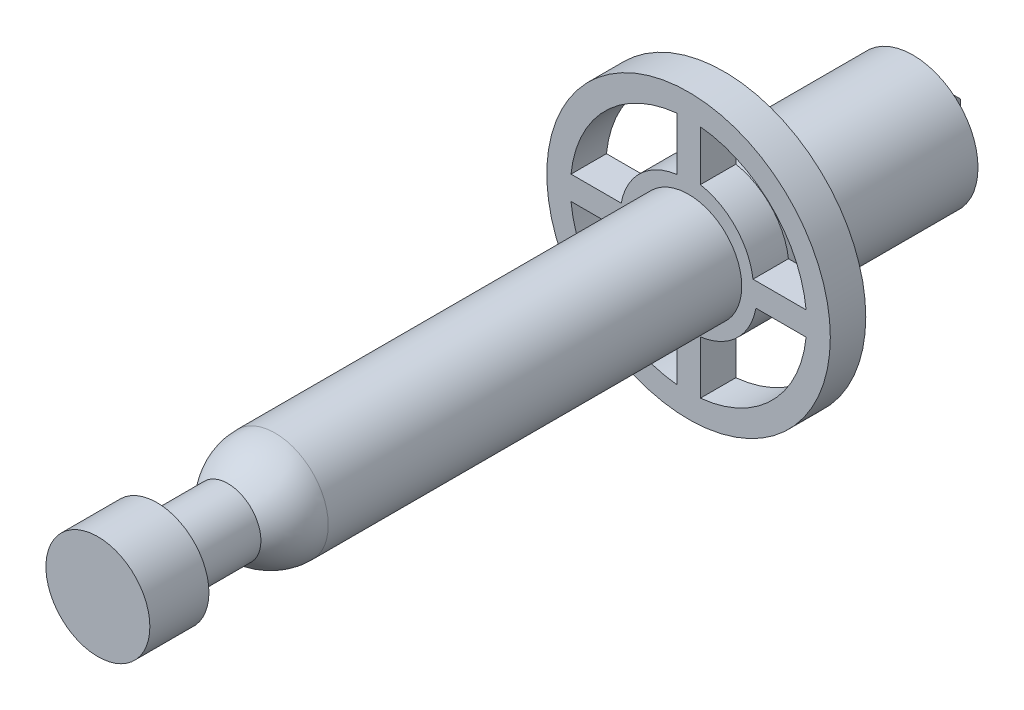
from build123d import *

# Parameters (mm, degrees)
SKETCH1_R           = 2.75
BOSS_EXTRUDE1_DEPTH = 8
SKETCH5_R           = 2.25
BOSS_EXTRUDE2_DEPTH = 19
SKETCH6_R           = 6
BOSS_EXTRUDE4_DEPTH = 1.5
CUT_EXTRUDE1_DEPTH  = 1.5
CIRPATTERN1_COUNT   = 4
SKETCH11_R          = 1.4
BOSS_EXTRUDE5_DEPTH = 3
SKETCH12_R          = 2.2
BOSS_EXTRUDE6_DEPTH = 2.5


with BuildPart() as part:
    # Sketch1 → Boss-Extrude1 (new body)
    with BuildSketch(Plane.XY):
        with Locations((0, -0.147315355)):
            Circle(SKETCH1_R)
    extrude(amount=BOSS_EXTRUDE1_DEPTH)

    # Sketch4 → Revolve2 (revolve)
    with BuildSketch(Plane(origin=(0, 0, 0), x_dir=(1, 0, 0), z_dir=(0, 1, 0))):
        Polygon((0, 0), (0, 2), (-2, 0), align=None)
    revolve(axis=Axis((0, 0, 0), (0, 0, -1)))

    # Sketch5 → Boss-Extrude2 (add)
    with BuildSketch(Plane.XY.offset(8)):
        Circle(SKETCH5_R)
    extrude(amount=BOSS_EXTRUDE2_DEPTH)

    # Sketch6 → Boss-Extrude4 (add)
    with BuildSketch(Plane.XY.offset(8)):
        Circle(SKETCH6_R)
    extrude(amount=BOSS_EXTRUDE4_DEPTH)

    # Sketch7 → Cut-Extrude1 (cut)
    with BuildSketch(Plane(origin=(0, 0, 8), x_dir=(-1, 0, 0), z_dir=(0, 0, -1))):
        with BuildLine():
            ThreePointArc((0.5, -4.974937186), (3.535533906, -3.535533906), (4.974937186, -0.5))
            Line((4.974937186, -0.5), (2.727290513, -0.5))
            ThreePointArc((2.727290513, -0.5), (1.996550566, -2.038422395), (0.5, -2.851478812))
            Line((0.5, -2.851478812), (0.5, -4.974937186))
        make_face()
    cut_extrude1 = extrude(amount=-CUT_EXTRUDE1_DEPTH, mode=Mode.SUBTRACT)

    # CirPattern1: Cut-Extrude1 ×4 about axis
    cirpattern1_axis = Axis((0, 0, 8), (0, 0, 1))
    for i in range(1, CIRPATTERN1_COUNT):
        add(cut_extrude1.rotate(cirpattern1_axis, i * 360 / CIRPATTERN1_COUNT), mode=Mode.SUBTRACT)

    # Sketch10 → Revolve3 (revolve)
    with BuildSketch(Plane(origin=(0, 0, 0), x_dir=(0, 0, -1), z_dir=(1, 0, 0))):
        with BuildLine():
            Line((-27, 0), (-29, 0))
            Line((-29, 0), (-29, 1.4))
            add(Edge.make_bspline(
                [(-29, 1.4), (-28.086565691, 2.25), (-27, 2.25)],
                knots=[0, 0, 0, 1, 1, 1], degree=2))
            Line((-27, 2.25), (-27, 0))
        make_face()
    revolve(axis=Axis((0, 0, 27), (0, 0, 1)))

    # Sketch11 → Boss-Extrude5 (add)
    with BuildSketch(Plane.XY.offset(29)):
        Circle(SKETCH11_R)
    extrude(amount=BOSS_EXTRUDE5_DEPTH)

    # Sketch12 → Boss-Extrude6 (add)
    with BuildSketch(Plane.XY.offset(32)):
        Circle(SKETCH12_R)
    extrude(amount=BOSS_EXTRUDE6_DEPTH)


solid = part.part
